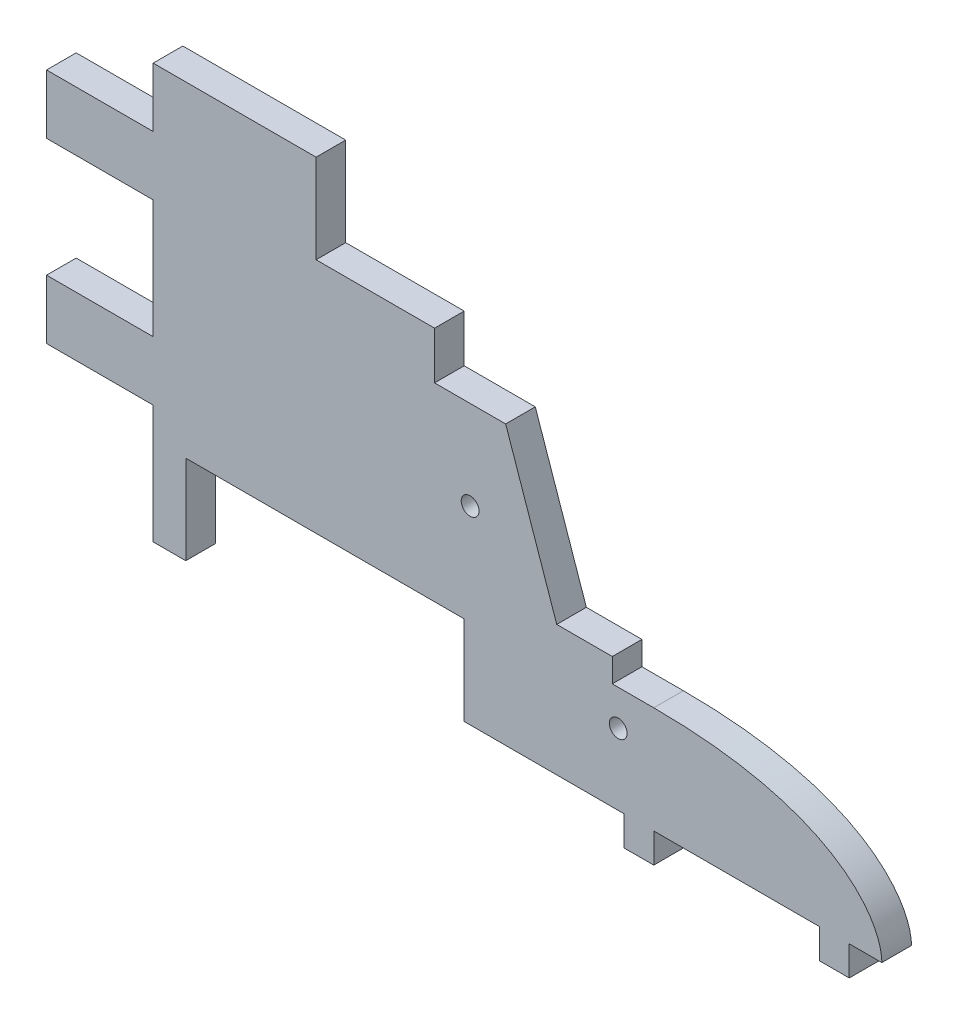
from build123d import *

# Parameters (mm, degrees)
ESQUISSE1_R             = 1.5
BOSS_EXTRU_1_DEPTH      = 5
BOSS_EXTRU_2_DEPTH      = 5
ESQUISSE4_W             = 5
ESQUISSE4_H             = 15
ENL_V_MAT_EXTRU_1_DEPTH = 10


with BuildPart() as part:
    # Esquisse1 → Boss.-Extru.1 (new body)
    with BuildSketch(Plane.XY):
        Polygon((0, 0), (32, 0), (32, -5), (37, -5), (37, 0), (37, 18), (22, 18), (12, 47), (0, 47), align=None)
        with Locations((6, 32)):
            Circle(ESQUISSE1_R, mode=Mode.SUBTRACT)
        with Locations((31, 12)):
            Circle(ESQUISSE1_R, mode=Mode.SUBTRACT)
    extrude(amount=BOSS_EXTRU_1_DEPTH)

    # Esquisse2 → Boss.-Extru.2 (add)
    with BuildSketch(Plane(origin=(0, 0, 0), x_dir=(-1, 0, 0), z_dir=(0, 0, -1))):
        with BuildLine():
            Line((-37, 0), (-65, 0))
            Line((-65, 0), (-65, -5))
            Line((-65, -5), (-70, -5))
            Line((-70, -5), (-70, 0))
            Line((-70, 0), (-75.5, 0))
            add(Edge.make_bspline(
                [(-75.5, 0), (-75.5, 5.982232529), (-67.685409636, 18), (-37, 18)],
                knots=[0, 0, 0, 0, 1, 1, 1, 1], degree=3))
            Line((-37, 18), (-37, 0))
        make_face()
        Polygon((42, 0), (47.5, 0), (47.5, 20), (65.5, 20), (65.5, 30), (47.5, 30), (47.5, 50), (65.5, 50), (65.5, 60), (47.5, 60), (47.5, 70), (20, 70), (20, 55), (0, 55), (0, 15), (42, 15), align=None)
        Polygon((-30, 18), (-22, 18), (-20.620689655, 22), (-30, 22), align=None)
    extrude(amount=-BOSS_EXTRU_2_DEPTH)

    # Esquisse4 → Enlèv. mat.-Extru.1 (cut)
    with BuildSketch(Plane(origin=(0, 0, 0), x_dir=(-1, 0, 0), z_dir=(0, 0, -1))):
        with Locations((-2.5, 7.5)):
            Rectangle(ESQUISSE4_W, ESQUISSE4_H)
    extrude(amount=-ENL_V_MAT_EXTRU_1_DEPTH, mode=Mode.SUBTRACT)


solid = part.part
